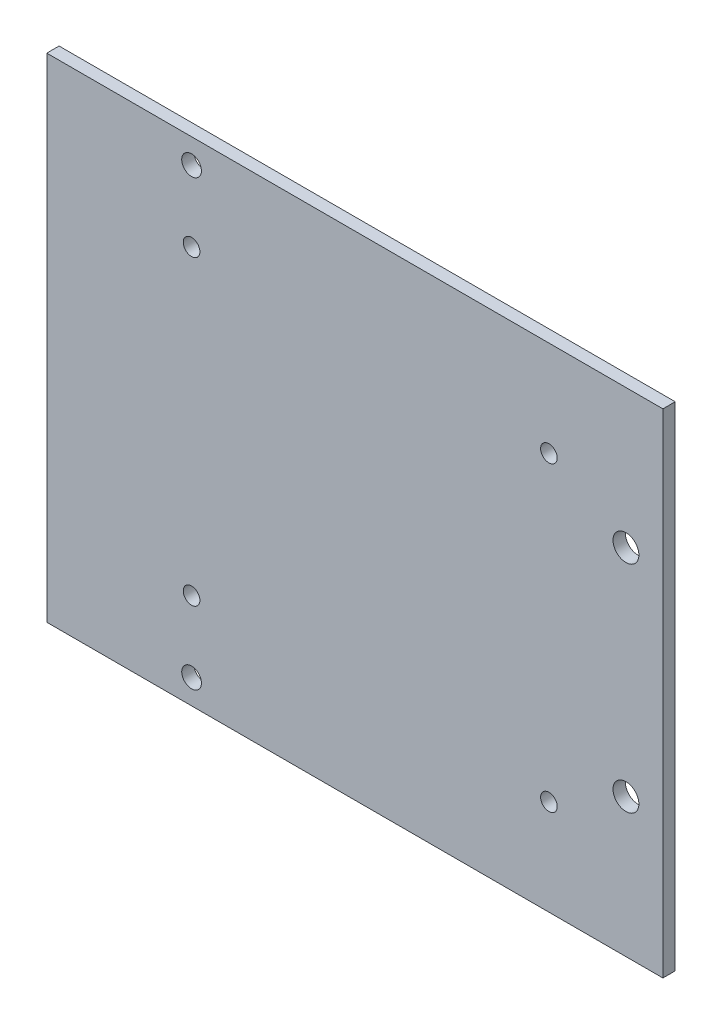
from build123d import *

# Parameters (mm, degrees)
SKETCH_1_W          = 100
SKETCH_1_H          = 80
EXTRUDE_1_DEPTH     = 2
SKETCH_3_R          = 1.35
CUT_EXTRUDE_1_DEPTH = 65.062469512
SKETCH_4_R          = 1.6
CUT_EXTRUDE_2_DEPTH = 65.062469512
SKETCH_5_R          = 1.6
CUT_EXTRUDE_3_DEPTH = 65.062469512
SKETCH_7_R          = 2.1
CUT_EXTRUDE_5_DEPTH = 10


with BuildPart() as part:
    # 草图1 → 凸台-拉伸1 (new body)
    with BuildSketch(Plane.XY):
        Rectangle(SKETCH_1_W, SKETCH_1_H)
    extrude(amount=EXTRUDE_1_DEPTH)

    # 草图3 → 切除-拉伸1 (cut, through all)
    with BuildSketch(Plane.XY.offset(2)):
        with Locations((-26.5, -24.5)):
            Circle(SKETCH_3_R)
        with Locations((-26.5, 24.5)):
            Circle(SKETCH_3_R)
        with Locations((31.5, 24.5)):
            Circle(SKETCH_3_R)
        with Locations((31.5, -24.5)):
            Circle(SKETCH_3_R)
    extrude(amount=-CUT_EXTRUDE_1_DEPTH, mode=Mode.SUBTRACT)

    # 草图4 → 切除-拉伸2 (cut, through all)
    with BuildSketch(Plane(origin=(0, 0, 0), x_dir=(-1, 0, 0), z_dir=(0, 0, -1))):
        with Locations((26.5, -36)):
            Circle(SKETCH_4_R)
    extrude(amount=-CUT_EXTRUDE_2_DEPTH, mode=Mode.SUBTRACT)

    # 草图5 → 切除-拉伸3 (cut, through all)
    with BuildSketch(Plane.XY.offset(2)):
        with Locations((-26.5, 36)):
            Circle(SKETCH_5_R)
    extrude(amount=-CUT_EXTRUDE_3_DEPTH, mode=Mode.SUBTRACT)

    # 草图7 → 切除-拉伸5 (cut)
    with BuildSketch(Plane.XY.offset(2)):
        with Locations((44, 17.5)):
            Circle(SKETCH_7_R)
        with Locations((44, -17.5)):
            Circle(SKETCH_7_R)
    extrude(amount=-CUT_EXTRUDE_5_DEPTH, mode=Mode.SUBTRACT)


solid = part.part
